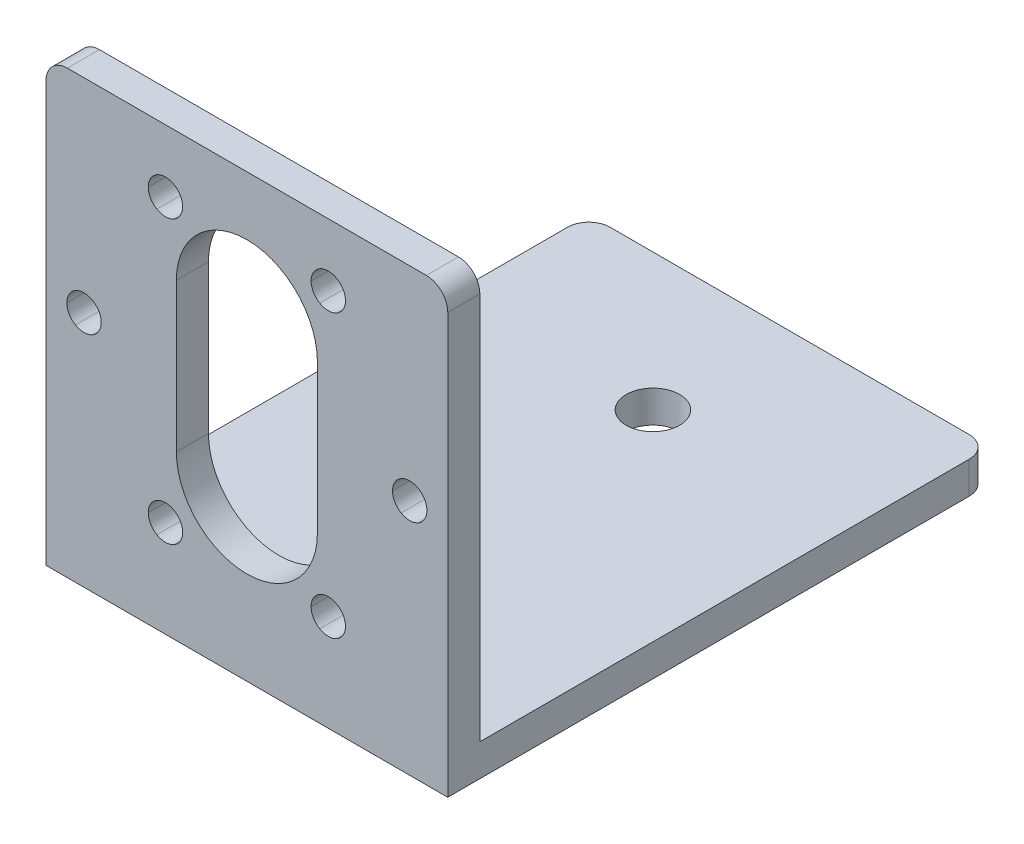
from build123d import *

# Parameters (mm, degrees)
BOSS_EXTRUDE1_DEPTH        = 3
BOSS_EXTRUDE2_DEPTH        = 1.5
BOSS_EXTRUDE2_DEPTH_BACK   = 1.5
SKETCH2_W                  = 37.6
SKETCH2_H                  = 50.8
FILLET2_R                  = 2
CUT_EXTRUDE2_REACH         = 69.217
SKETCH4_R                  = 1.6
CIRPATTERN1_COUNT          = 6
SZKIC1_R                   = 2.5
WYTNIJ_WYCI_GNI_CIE1_DEPTH = 10


with BuildPart() as part:
    # Sketch1 → Boss-Extrude1 (new body)
    with BuildSketch(Plane.XY):
        Polygon((-18.8, 0), (18.8, 0), (18.8, 22), (18.8, 39.799804834), (-18.8, 39.799804834), (-18.8, 22), align=None)
        with BuildLine():
            Line((-6.6, 13.799434154), (-6.6, 27.699434154))
            ThreePointArc((-6.6, 27.699434154), (0, 34.299458505), (6.6, 27.699434154))
            Line((6.6, 27.699434154), (6.6, 13.799434154))
            ThreePointArc((6.6, 13.799434154), (0, 7.199458505), (-6.6, 13.799434154))
        make_face(mode=Mode.SUBTRACT)
    extrude(amount=BOSS_EXTRUDE1_DEPTH)

    # Sketch2 → Boss-Extrude2 (add, two sides: drawn at the far end of the back side and taken through both)
    with BuildSketch(Plane.XZ.offset(-BOSS_EXTRUDE2_DEPTH_BACK)):
        with Locations((0, -22.4)):
            Rectangle(SKETCH2_W, SKETCH2_H)
    extrude(amount=BOSS_EXTRUDE2_DEPTH + BOSS_EXTRUDE2_DEPTH_BACK)

    # Fillet2
    fillet2_edges = [part.edges().sort_by_distance(p)[0] for p in [
        (-18.8, 39.799804834, 1.5),
        (18.8, 39.799804834, 1.5),
        (-18.8, 0, -47.8),
        (18.8, 0, -47.8),
    ]]
    fillet(fillet2_edges, radius=FILLET2_R)

    # Sketch4 → Cut-Extrude2 (cut, up to next)
    with BuildSketch(Plane.XY.offset(3), mode=Mode.PRIVATE) as cut_extrude2_sk1:
        with Locations((7.619805215, 33.947348281)):
            Circle(SKETCH4_R)
    cut_extrude2_tool1 = extrude(cut_extrude2_sk1.sketch, amount=-CUT_EXTRUDE2_REACH, mode=Mode.PRIVATE) & part.part
    # Sketch4 → Cut-Extrude2 (cut, up to next)
    with BuildSketch(Plane.XY.offset(3), mode=Mode.PRIVATE) as cut_extrude2_sk2:
        with Locations((15.23961043, 20.749458505)):
            Circle(SKETCH4_R)
    cut_extrude2_tool2 = extrude(cut_extrude2_sk2.sketch, amount=-CUT_EXTRUDE2_REACH, mode=Mode.PRIVATE) & part.part
    # Sketch4 → Cut-Extrude2 (cut, up to next)
    with BuildSketch(Plane.XY.offset(3), mode=Mode.PRIVATE) as cut_extrude2_sk3:
        with Locations((7.619805215, 7.551568728)):
            Circle(SKETCH4_R)
    cut_extrude2_tool3 = extrude(cut_extrude2_sk3.sketch, amount=-CUT_EXTRUDE2_REACH, mode=Mode.PRIVATE) & part.part
    # Sketch4 → Cut-Extrude2 (cut, up to next)
    with BuildSketch(Plane.XY.offset(3), mode=Mode.PRIVATE) as cut_extrude2_sk4:
        with Locations((-7.619805215, 7.551568728)):
            Circle(SKETCH4_R)
    cut_extrude2_tool4 = extrude(cut_extrude2_sk4.sketch, amount=-CUT_EXTRUDE2_REACH, mode=Mode.PRIVATE) & part.part
    # Sketch4 → Cut-Extrude2 (cut, up to next)
    with BuildSketch(Plane.XY.offset(3), mode=Mode.PRIVATE) as cut_extrude2_sk5:
        with Locations((-15.23961043, 20.749458505)):
            Circle(SKETCH4_R)
    cut_extrude2_tool5 = extrude(cut_extrude2_sk5.sketch, amount=-CUT_EXTRUDE2_REACH, mode=Mode.PRIVATE) & part.part
    # Sketch4 → Cut-Extrude2 (cut, up to next)
    with BuildSketch(Plane.XY.offset(3), mode=Mode.PRIVATE) as cut_extrude2_sk6:
        with Locations((-7.619805215, 33.947348281)):
            Circle(SKETCH4_R)
    cut_extrude2_tool6 = extrude(cut_extrude2_sk6.sketch, amount=-CUT_EXTRUDE2_REACH, mode=Mode.PRIVATE) & part.part
    cut_extrude2_1 = cut_extrude2_tool1.solids().sort_by_distance((7.619805, 33.947348, 3))[0]
    add(cut_extrude2_1, mode=Mode.SUBTRACT)
    cut_extrude2_2 = cut_extrude2_tool2.solids().sort_by_distance((15.23961, 20.749459, 3))[0]
    add(cut_extrude2_2, mode=Mode.SUBTRACT)
    cut_extrude2_3 = cut_extrude2_tool3.solids().sort_by_distance((7.619805, 7.551569, 3))[0]
    add(cut_extrude2_3, mode=Mode.SUBTRACT)
    cut_extrude2_4 = cut_extrude2_tool4.solids().sort_by_distance((-7.619805, 7.551569, 3))[0]
    add(cut_extrude2_4, mode=Mode.SUBTRACT)
    cut_extrude2_5 = cut_extrude2_tool5.solids().sort_by_distance((-15.23961, 20.749459, 3))[0]
    add(cut_extrude2_5, mode=Mode.SUBTRACT)
    cut_extrude2_6 = cut_extrude2_tool6.solids().sort_by_distance((-7.619805, 33.947348, 3))[0]
    add(cut_extrude2_6, mode=Mode.SUBTRACT)
    cut_extrude2 = cut_extrude2_1 + cut_extrude2_2 + cut_extrude2_3 + cut_extrude2_4 + cut_extrude2_5 + cut_extrude2_6  # Cut-Extrude2 as one shape, for the pattern or mirror that repeats it

    # CirPattern1: Cut-Extrude2 ×6 about axis
    cirpattern1_axis = Axis((0, 20.759090909, 0), (0, 0, 1))
    for i in range(1, CIRPATTERN1_COUNT):
        add(cut_extrude2.rotate(cirpattern1_axis, i * 360 / CIRPATTERN1_COUNT), mode=Mode.SUBTRACT)

    # Szkic1 → Wytnij-wyciągnięcie1 (cut)
    with BuildSketch(Plane(origin=(0, 1.5, 0), x_dir=(1, 0, 0), z_dir=(0, 1, 0))):
        with Locations(Location((0, 15, 0), (0, 0, 180))):
            Circle(SZKIC1_R)
        with Locations(Location((0, 35, 0), (0, 0, 180))):
            Circle(SZKIC1_R)
    extrude(amount=-WYTNIJ_WYCI_GNI_CIE1_DEPTH, mode=Mode.SUBTRACT)


solid = part.part
